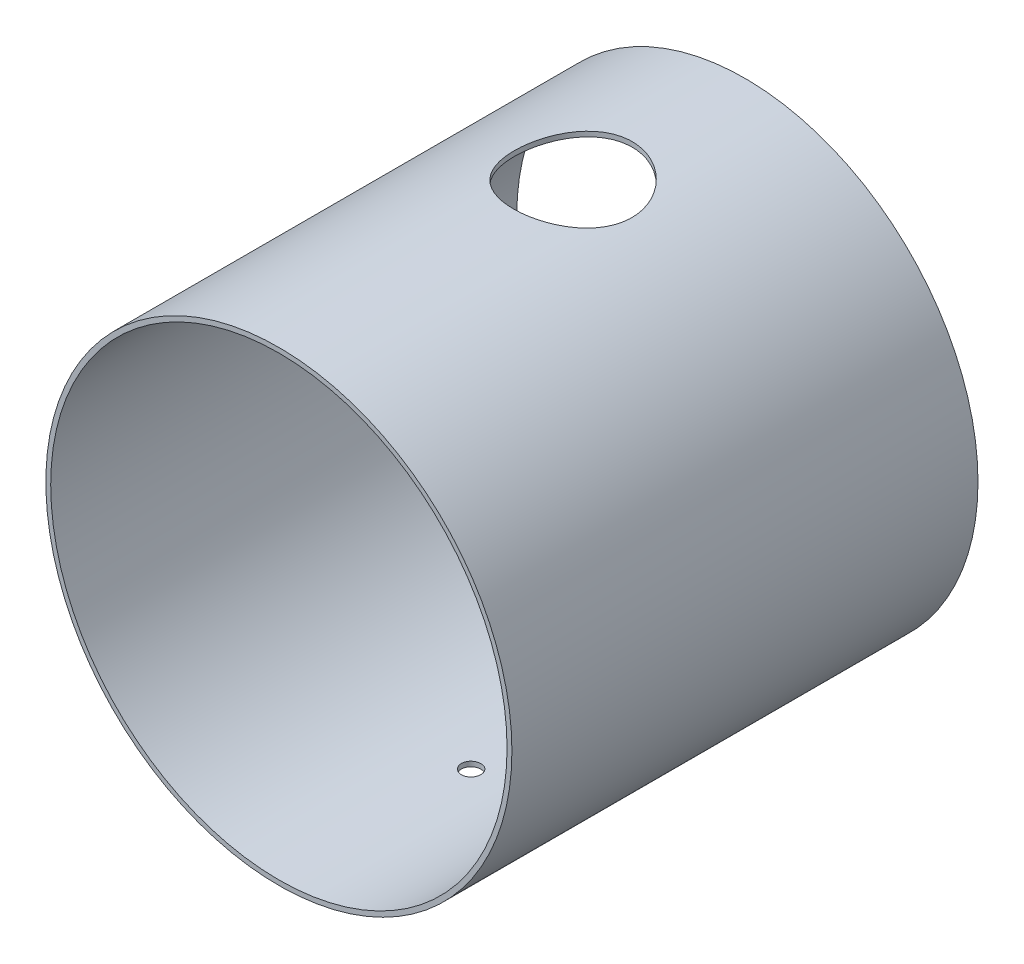
from build123d import *

# Parameters (mm, degrees)
SKETCH3_R                                = 152.4
SKETCH3_R_2                              = 149.225
BOSS_EXTRUDE1_DEPTH                      = 152.4
F_1_0MM_DOWEL_HOLE1_REACH                = 394.408
F_1_0MM_DOWEL_HOLE1_BORE_R               = 38.5
F_1_2_0_5_DIAMETER_HOLE1_REACH           = 394.606
F_1_2_0_5_DIAMETER_HOLE1_BORE_R          = 6.35
F_1_2_0_5_DIAMETER_HOLE1_ON_FACE_2_REACH = 387.1
F_1_2_0_5_DIAMETER_HOLE1_BORE_2_R        = 6.35


with BuildPart() as part:
    # Sketch3 → Boss-Extrude1 (new, symmetric)
    with BuildSketch(Plane.XY):
        with Locations(Location((0, 0, 0), (0, 0, 180))):
            Circle(SKETCH3_R)
        with Locations(Location((0, 0, 0), (0, 0, 180))):
            Circle(SKETCH3_R_2, mode=Mode.SUBTRACT)
    extrude(amount=BOSS_EXTRUDE1_DEPTH, both=True)

    # Ø1.0mm Dowel Hole1 bore (on position points) → Ø1.0mm Dowel Hole1 (cut, up to next)
    with BuildSketch(Plane(origin=(-1.237560308, 152.394975129, -41.195571985), x_dir=(0.999967028404, 0.008120474463, 0), z_dir=(-0.008120474463, 0.999967028404, 0)), mode=Mode.PRIVATE) as f_1_0mm_dowel_hole1_sk1:
        Circle(F_1_0MM_DOWEL_HOLE1_BORE_R)
    f_1_0mm_dowel_hole1_tool1 = extrude(f_1_0mm_dowel_hole1_sk1.sketch, amount=-F_1_0MM_DOWEL_HOLE1_REACH, mode=Mode.PRIVATE) & part.part
    add(f_1_0mm_dowel_hole1_tool1.solids().sort_by_distance((-1.23756, 152.394975, -41.195572))[0], mode=Mode.SUBTRACT)

    # 1/2 (0.5) Diameter Hole1 bore (on position points) → 1/2 (0.5) Diameter Hole1 (cut, up to next)
    with BuildSketch(Plane(origin=(-0.547224497, -152.399017534, -42.136286286), x_dir=(-0.999993553373, 0.003590711924, 0), z_dir=(-0.003590711924, -0.999993553373, 0)), mode=Mode.PRIVATE) as f_1_2_0_5_diameter_hole1_sk1:
        Circle(F_1_2_0_5_DIAMETER_HOLE1_BORE_R)
    f_1_2_0_5_diameter_hole1_tool1 = extrude(f_1_2_0_5_diameter_hole1_sk1.sketch, amount=-F_1_2_0_5_DIAMETER_HOLE1_REACH, mode=Mode.PRIVATE) & part.part
    add(f_1_2_0_5_diameter_hole1_tool1.solids().sort_by_distance((-0.547224, -152.399018, -42.136286))[0], mode=Mode.SUBTRACT)

    # 1/2 (0.5) Diameter Hole1 bore 2 (on position points) → 1/2 (0.5) Diameter Hole1 on face 2 (cut, up to next)
    with BuildSketch(Plane(origin=(0.182408166, -152.399890837, 26.814000364), x_dir=(-0.999999283595, -0.001197000339, 0), z_dir=(0.001197000339, -0.999999283595, 0)), mode=Mode.PRIVATE) as f_1_2_0_5_diameter_hole1_on_face_2_sk1:
        Circle(F_1_2_0_5_DIAMETER_HOLE1_BORE_2_R)
    f_1_2_0_5_diameter_hole1_on_face_2_tool1 = extrude(f_1_2_0_5_diameter_hole1_on_face_2_sk1.sketch, amount=-F_1_2_0_5_DIAMETER_HOLE1_ON_FACE_2_REACH, mode=Mode.PRIVATE) & part.part
    add(f_1_2_0_5_diameter_hole1_on_face_2_tool1.solids().sort_by_distance((0.182408, -152.399891, 26.814))[0], mode=Mode.SUBTRACT)


solid = part.part
